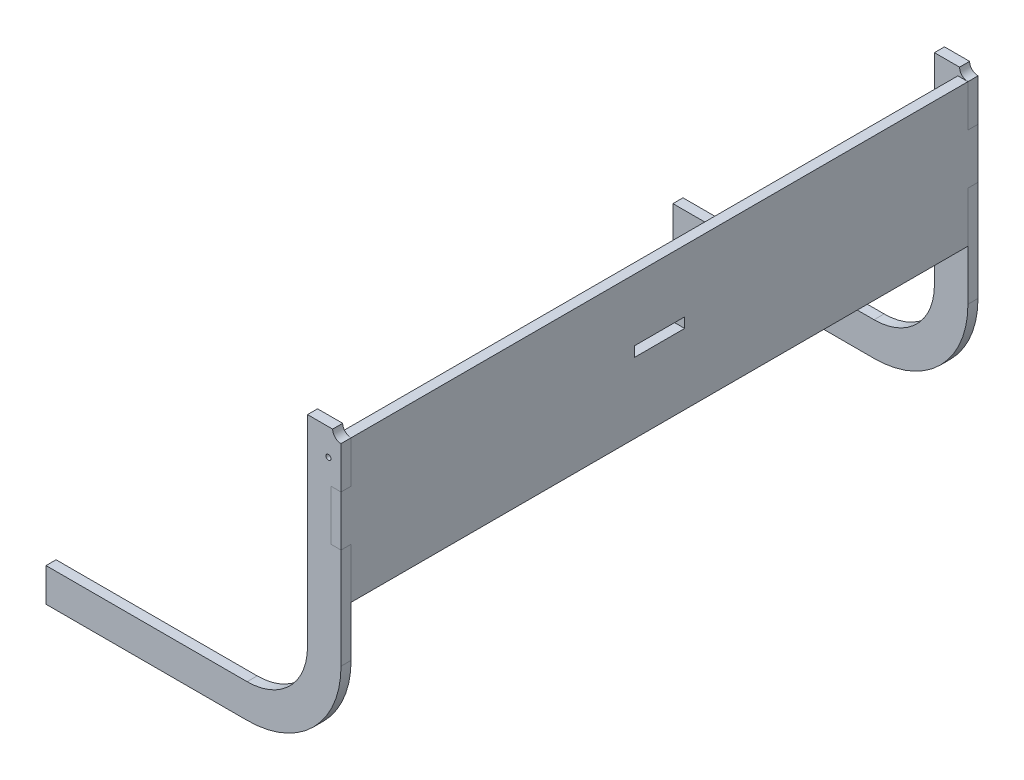
from build123d import *

# Parameters (mm, degrees)
BOSS_EXTRUDE1_DEPTH     = 3
BOSS_EXTRUDE2_START     = -190
BOSS_EXTRUDE2_DEPTH     = 3
CUT_EXTRUDE1_DEPTH      = 229.309001137
CUT_EXTRUDE1_DEPTH_BACK = 229.309001137
SKETCH2_W               = 3
SKETCH2_H               = 15
SKETCH3_W               = 3
SKETCH3_H               = 15
BOSS_EXTRUDE3_DEPTH     = 3
CUT_EXTRUDE2_DEPTH      = 276.472321659
CUT_EXTRUDE2_DEPTH_BACK = 276.472321659
SKETCH6_R               = 2.5
CUT_EXTRUDE3_DEPTH      = 233.172349775
CUT_EXTRUDE3_DEPTH_BACK = 233.172349775
SKETCH7_W               = 184
SKETCH7_H               = 2.5
CUT_EXTRUDE4_DEPTH      = 232.051942212
CUT_EXTRUDE4_DEPTH_BACK = 232.051942212
SKETCH8_W               = 15
SKETCH8_H               = 3
CUT_EXTRUDE6_DEPTH      = 276.472321659
CUT_EXTRUDE6_DEPTH_BACK = 276.472321659
CUT_EXTRUDE7_DEPTH      = 276.472321659
CUT_EXTRUDE7_DEPTH_BACK = 276.472321659
SKETCH12_R              = 0.75


with BuildPart() as part:
    # Sketch1 → Boss-Extrude1 (new body)
    with BuildSketch(Plane.XY.offset(196)):
        with BuildLine():
            Line((91, -68), (31, -68))
            ThreePointArc((31, -68), (25.343145751, -65.656854249), (23, -60))
            Line((23, -60), (23, 0))
            Line((23, 0), (3, 0))
            Line((3, 0), (3, -60))
            ThreePointArc((3, -60), (11.201010127, -79.798989873), (31, -88))
            Line((31, -88), (91, -88))
            Line((91, -88), (91, -68))
        make_face()
    extrude(amount=-BOSS_EXTRUDE1_DEPTH)


with BuildPart() as body_2:
    # Sketch1<2> → Boss-Extrude2 (new body)
    with BuildSketch(Plane.XY.offset(196).offset(BOSS_EXTRUDE2_START)):
        with BuildLine():
            Line((91, -68), (31, -68))
            ThreePointArc((31, -68), (25.343145751, -65.656854249), (23, -60))
            Line((23, -60), (23, 0))
            Line((23, 0), (3, 0))
            Line((3, 0), (3, -60))
            ThreePointArc((3, -60), (11.201010127, -79.798989873), (31, -88))
            Line((31, -88), (91, -88))
            Line((91, -88), (91, -68))
        make_face()
    extrude(amount=BOSS_EXTRUDE2_DEPTH)


with BuildPart() as cut_extrude1_tool:
    # Sketch2 → Cut-Extrude1 (new, two sides: drawn at the far end of the back side and taken through both)
    with BuildSketch(Plane.XY.offset(196).offset(-CUT_EXTRUDE1_DEPTH_BACK)):
        with Locations((4.5, -22.5)):
            Rectangle(SKETCH2_W, SKETCH2_H)
    extrude(amount=CUT_EXTRUDE1_DEPTH + CUT_EXTRUDE1_DEPTH_BACK)


with BuildPart() as part_1:
    add(part.part)

    # Cut-Extrude1: cut by cut_extrude1_tool
    add(cut_extrude1_tool.part, mode=Mode.SUBTRACT)


with BuildPart() as body_2_1:
    add(body_2.part)

    # Cut-Extrude1: cut by cut_extrude1_tool
    add(cut_extrude1_tool.part, mode=Mode.SUBTRACT)


with BuildPart() as body_3:
    # Sketch3 → Boss-Extrude3 (new body)
    with BuildSketch(Plane.ZY.offset(-3)):
        Polygon((193, 0), (9, 0), (9, -45), (193, -45), (193, -30), (193, -15), align=None)
        with Locations((7.5, -22.5)):
            Rectangle(SKETCH3_W, SKETCH3_H)
        with Locations((194.5, -22.5)):
            Rectangle(SKETCH3_W, SKETCH3_H)
    extrude(amount=-BOSS_EXTRUDE3_DEPTH)


with BuildPart() as body_4:
    # Mirror1: mirrored copy
    add(body_3.part.mirror(Plane(origin=(91, -88, 193), x_dir=(0, 0, 1), z_dir=(1, 0, 0))))


with BuildPart() as body_5:
    # Mirror1 2: mirrored copy
    add(part_1.part.mirror(Plane(origin=(91, -88, 193), x_dir=(0, 0, 1), z_dir=(1, 0, 0))))


with BuildPart() as body_6:
    # Mirror1 3: mirrored copy
    add(body_2_1.part.mirror(Plane(origin=(91, -88, 193), x_dir=(0, 0, 1), z_dir=(1, 0, 0))))


with BuildPart() as cut_extrude2_tool:
    # Sketch6 → Cut-Extrude2 (new, two sides: drawn at the far end of the back side and taken through both)
    with BuildSketch(Plane.XY.offset(196).offset(-CUT_EXTRUDE2_DEPTH_BACK)):
        with Locations((179, 0)):
            Circle(SKETCH6_R)
    extrude(amount=CUT_EXTRUDE2_DEPTH + CUT_EXTRUDE2_DEPTH_BACK)


with BuildPart() as body_4_1:
    add(body_4.part)

    # Cut-Extrude2: cut by cut_extrude2_tool
    add(cut_extrude2_tool.part, mode=Mode.SUBTRACT)

    # Sketch7 → Cut-Extrude3 (cut, two sides: drawn at the far end of the back side and taken through both)
    with BuildSketch(Plane(origin=(179, 0, 0), x_dir=(0, 0, -1), z_dir=(1, 0, 0)).offset(-CUT_EXTRUDE3_DEPTH_BACK)):
        with Locations((-101, -1.25)):
            Rectangle(SKETCH7_W, SKETCH7_H)
    extrude(amount=CUT_EXTRUDE3_DEPTH + CUT_EXTRUDE3_DEPTH_BACK, mode=Mode.SUBTRACT)

    # Sketch8 → Cut-Extrude4 (cut, two sides: drawn at the far end of the back side and taken through both)
    with BuildSketch(Plane.ZY.offset(-176).offset(-CUT_EXTRUDE4_DEPTH_BACK)):
        with Locations((101, -22.5)):
            Rectangle(SKETCH8_W, SKETCH8_H)
    extrude(amount=CUT_EXTRUDE4_DEPTH + CUT_EXTRUDE4_DEPTH_BACK, mode=Mode.SUBTRACT)


with BuildPart() as body_5_1:
    add(body_5.part)

    # Cut-Extrude2: cut by cut_extrude2_tool
    add(cut_extrude2_tool.part, mode=Mode.SUBTRACT)


with BuildPart() as body_6_1:
    add(body_6.part)

    # Cut-Extrude2: cut by cut_extrude2_tool
    add(cut_extrude2_tool.part, mode=Mode.SUBTRACT)


with BuildPart() as cut_extrude6_tool:
    # Sketch11 → Cut-Extrude6 (new, two sides: drawn at the far end of the back side and taken through both)
    with BuildSketch(Plane.XY.offset(196).offset(-CUT_EXTRUDE6_DEPTH_BACK)):
        with BuildLine():
            Line((91, -68), (151, -68))
            ThreePointArc((151, -68), (156.656854249, -65.656854249), (159, -60))
            Line((159, -60), (159, 0))
            Line((159, 0), (169, 0))
            Line((169, 0), (169, -60))
            ThreePointArc((169, -60), (163.727922061, -72.727922061), (151, -78))
            Line((151, -78), (91, -78))
            Line((91, -78), (91, -68))
        make_face()
    extrude(amount=CUT_EXTRUDE6_DEPTH + CUT_EXTRUDE6_DEPTH_BACK)


with BuildPart() as body_5_2:
    add(body_5_1.part)

    # Cut-Extrude6: cut by cut_extrude6_tool
    add(cut_extrude6_tool.part, mode=Mode.SUBTRACT)


with BuildPart() as body_6_2:
    add(body_6_1.part)

    # Cut-Extrude6: cut by cut_extrude6_tool
    add(cut_extrude6_tool.part, mode=Mode.SUBTRACT)


with BuildPart() as cut_extrude7_tool:
    # Sketch12 → Cut-Extrude7 (new, two sides: drawn at the far end of the back side and taken through both)
    with BuildSketch(Plane(origin=(0, 0, 6), x_dir=(-1, 0, 0), z_dir=(0, 0, -1)).offset(-CUT_EXTRUDE7_DEPTH_BACK)):
        with Locations((-175.25, -7.90569415)):
            Circle(SKETCH12_R)
    extrude(amount=CUT_EXTRUDE7_DEPTH + CUT_EXTRUDE7_DEPTH_BACK)


with BuildPart() as body_5_3:
    add(body_5_2.part)

    # Cut-Extrude7: cut by cut_extrude7_tool
    add(cut_extrude7_tool.part, mode=Mode.SUBTRACT)


with BuildPart() as body_6_3:
    add(body_6_2.part)

    # Cut-Extrude7: cut by cut_extrude7_tool
    add(cut_extrude7_tool.part, mode=Mode.SUBTRACT)


solid = Compound([body_4_1.part, body_5_3.part, body_6_3.part])
